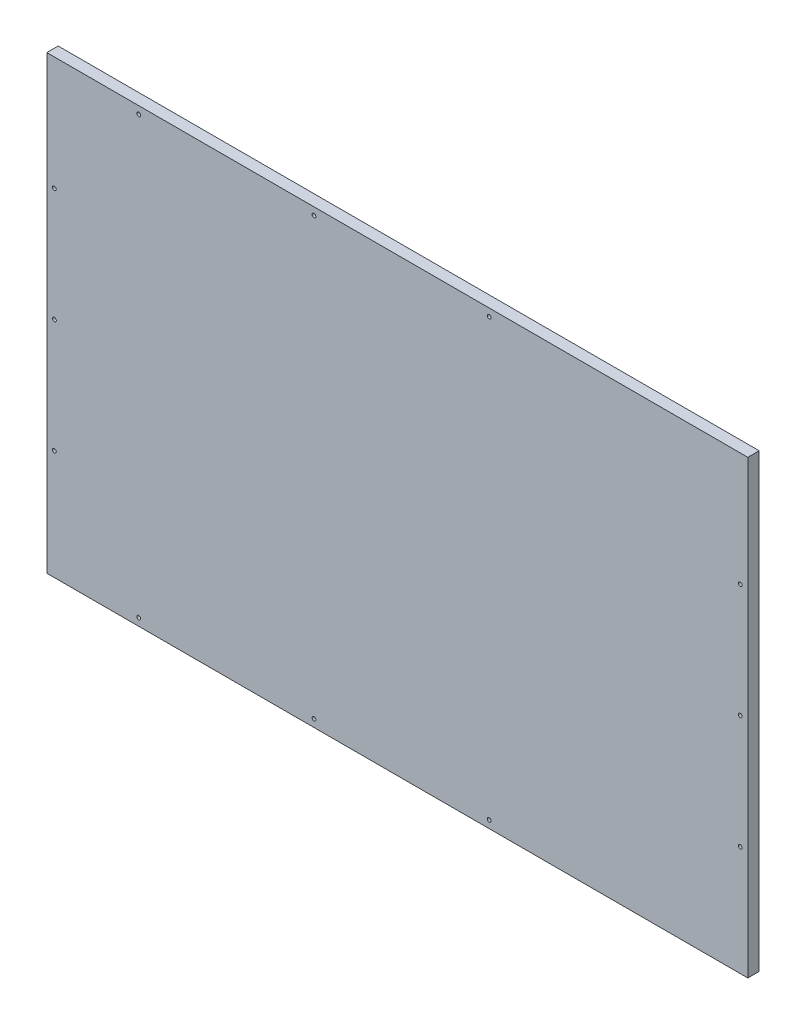
from build123d import *

# Parameters (mm, degrees)
SKETCH_1_W          = 925
SKETCH_1_H          = 595
EXTRUDE_1_DEPTH     = 15
SKETCH_2_R          = 2.5
CUT_EXTRUDE_1_DEPTH = 551.124985799
SKETCH_2_3_R        = 2.5
CUT_EXTRUDE_2_DEPTH = 551.124985799


with BuildPart() as part:
    # ｽｹｯﾁ1 → ﾎﾞｽ - 押し出し1 (new body)
    with BuildSketch(Plane.XY):
        Rectangle(SKETCH_1_W, SKETCH_1_H)
    extrude(amount=EXTRUDE_1_DEPTH)

    # ｽｹｯﾁ2 → ｶｯﾄ - 押し出し1 (cut, through all)
    with BuildSketch(Plane.XY.offset(15)):
        with Locations((-341.25, 287.5)):
            Circle(SKETCH_2_R)
        with Locations((-110, 287.5)):
            Circle(SKETCH_2_R)
        with Locations((121.25, 287.5)):
            Circle(SKETCH_2_R)
    cut_extrude_1 = extrude(amount=-CUT_EXTRUDE_1_DEPTH, mode=Mode.SUBTRACT)

    # ｽｹｯﾁ2<3> → ｶｯﾄ - 押し出し2 (cut, through all)
    with BuildSketch(Plane.XY.offset(15)):
        with Locations((-452.5, 147.5)):
            Circle(SKETCH_2_3_R)
        with Locations((-452.5, -2.5)):
            Circle(SKETCH_2_3_R)
        with Locations((-452.5, -152.5)):
            Circle(SKETCH_2_3_R)
    cut_extrude_2 = extrude(amount=-CUT_EXTRUDE_2_DEPTH, mode=Mode.SUBTRACT)

    # ﾐﾗｰ1: ｶｯﾄ - 押し出し1 across plane
    add(cut_extrude_1.mirror(Plane.ZX), mode=Mode.SUBTRACT)

    # ﾐﾗｰ2: ｶｯﾄ - 押し出し2 across plane
    add(cut_extrude_2.mirror(Plane(origin=(0, 0, 0), x_dir=(0, 0, 1), z_dir=(1, 0, 0))), mode=Mode.SUBTRACT)


solid = part.part
